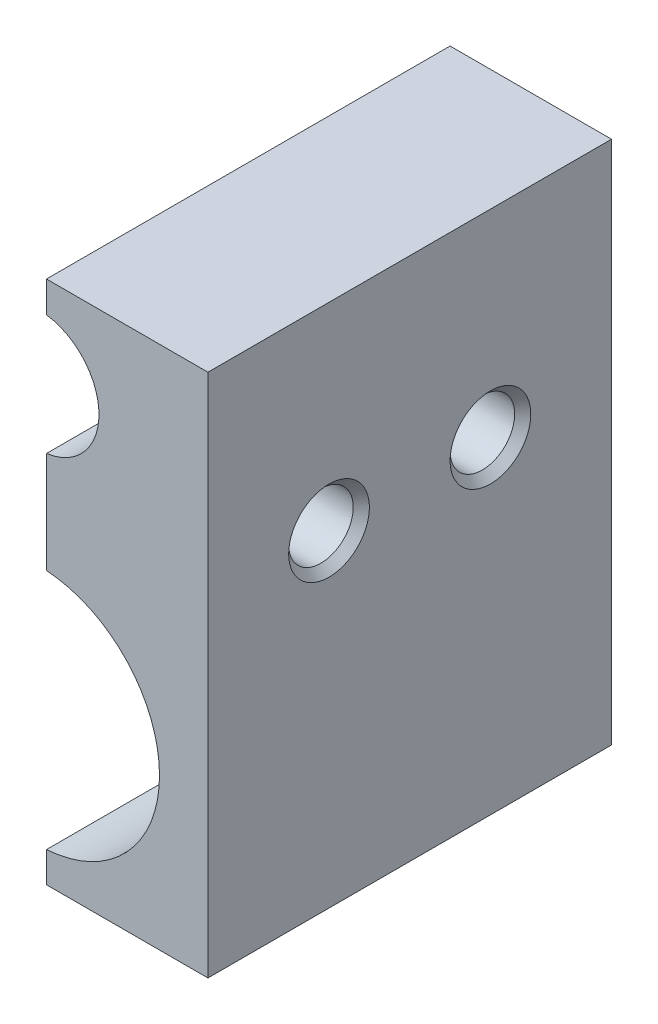
from build123d import *

# Parameters (mm, degrees)
BOSS_EXTRUDE1_DEPTH = 50
SKETCH2_R           = 4
CUT_EXTRUDE1_DEPTH  = 20
CHAMFER1_SIZE       = 1


with BuildPart() as part:
    # Sketch1 → Boss-Extrude1 (new body)
    with BuildSketch(Plane.XY):
        with BuildLine():
            Line((0, 0), (20, 0))
            Line((20, 0), (20, 65))
            Line((20, 65), (0, 65))
            Line((0, 65), (0, 61.14955156))
            ThreePointArc((0, 61.14955156), (6.5, 53.716517187), (0, 46.283482813))
            Line((0, 46.283482813), (0, 33.716517187))
            ThreePointArc((0, 33.716517187), (14, 18.74988764), (0, 3.783258093))
            Line((0, 3.783258093), (0, 0))
        make_face()
    extrude(amount=BOSS_EXTRUDE1_DEPTH)

    # Sketch2 → Cut-Extrude1 (cut)
    with BuildSketch(Plane(origin=(20, 0, 0), x_dir=(0, 0, -1), z_dir=(1, 0, 0))):
        with Locations((-35, 40.505102572)):
            Circle(SKETCH2_R)
        with Locations((-15, 40.505102572)):
            Circle(SKETCH2_R)
    extrude(amount=-CUT_EXTRUDE1_DEPTH, mode=Mode.SUBTRACT)

    # Chamfer1
    chamfer1_edges = [part.edges().sort_by_distance(p)[0] for p in [
        (20, 40.505102572, 39),
        (20, 40.505102572, 19),
    ]]
    chamfer(chamfer1_edges, length=CHAMFER1_SIZE)


solid = part.part
